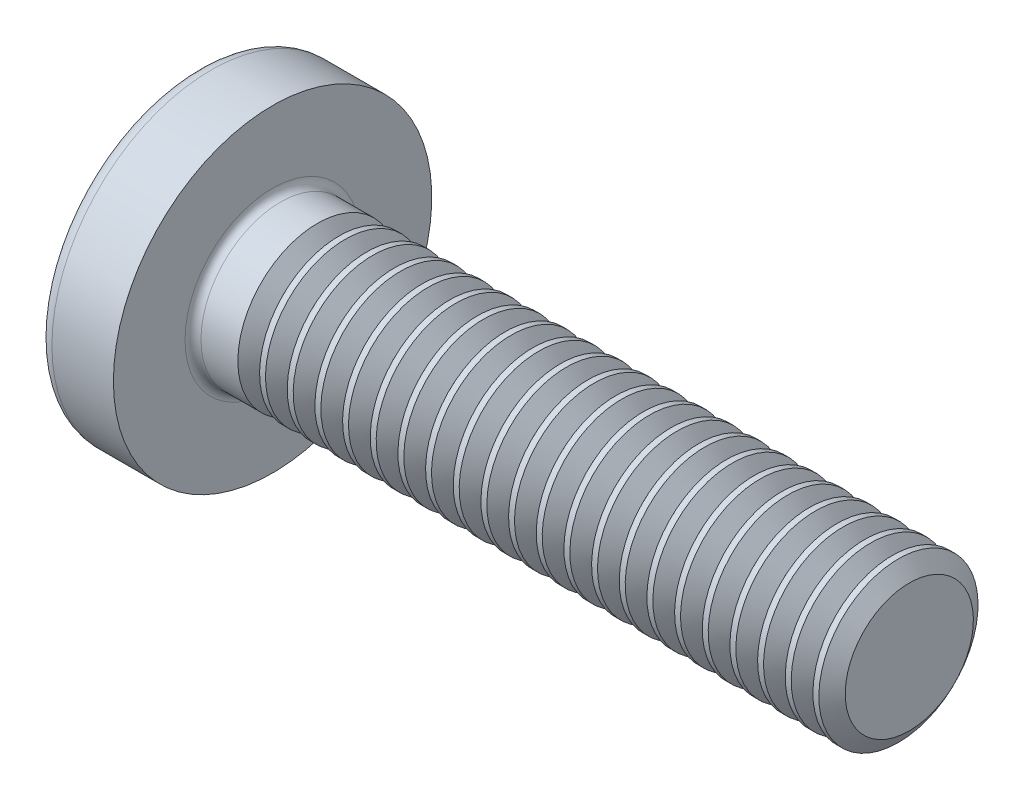
from build123d import *

# Parameters (mm, degrees)
FILLET1_R       = 0.2
RECPAT_COUNT    = 2
RECPAT_ANGLE    = 90
THDSCHPAT_COUNT = 22
THDSCHPAT_PITCH = 0.695238095


with BuildPart() as part:
    # BodySke → Base-Revolve (revolve)
    with BuildSketch(Plane.XY, mode=Mode.PRIVATE) as base_revolve_sk:
        with BuildLine():
            Line((3.1, 2), (3.1, 4))
            Line((3.1, 4), (1.555305874, 4))
            ThreePointArc((1.555305874, 4), (1.392873227, 3.961271902), (1.265388955, 3.853420195))
            ThreePointArc((1.265388955, 3.853420195), (0.324444487, 2.027933456), (0, 0))
            Line((0, 0), (19.1, 0))
            Line((19.1, 0), (19.1, 2))
            Line((19.1, 2), (3.1, 2))
        make_face()
    revolve(base_revolve_sk.sketch.rotate(Axis((1.555305874, 0, 0), (1, 0, 0)), 90), axis=Axis((1.555305874, 0, 0), (1, 0, 0)))

    # Fillet1
    fillet1_edges = [part.edges().sort_by_distance(p)[0] for p in [
        (3.1, 0, -2),
    ]]
    fillet(fillet1_edges, radius=FILLET1_R)

    # Sketch3 → Recess section 0
    with BuildSketch(Plane(origin=(0, 0, 0), x_dir=(0, 0, -1), z_dir=(1, 0, 0))):
        with BuildLine():
            Line((0.515, -2.15), (-0.515, -2.15))
            Line((-0.515, -2.15), (-0.515, 2.15))
            Line((-0.515, 2.15), (0.515, 2.15))
            Line((0.515, 2.15), (0.515, -2.15))
        make_face()
    # Sketch4 → Recess section 1
    with BuildSketch(Plane(origin=(2.34, 0, 0), x_dir=(0, 0, -1), z_dir=(1, 0, 0))):
        with BuildLine():
            Line((0.515, -0.983319232), (-0.515, -0.983319232))
            Line((-0.515, -0.983319232), (-0.515, 0.983319232))
            Line((-0.515, 0.983319232), (0.515, 0.983319232))
            Line((0.515, 0.983319232), (0.515, -0.983319232))
        make_face()
    recess = loft(mode=Mode.SUBTRACT)

    # RecPat: Recess ×2 about axis
    recpat_axis = Axis((0, 0, 0), (1, 0, 0))
    for i in range(1, RECPAT_COUNT):
        add(recess.rotate(recpat_axis, i * RECPAT_ANGLE / (RECPAT_COUNT - 1)), mode=Mode.SUBTRACT)

    # RecCorSke → RecessCore (revolve, cut)
    with BuildSketch(Plane.XY, mode=Mode.PRIVATE) as recesscore_sk:
        Polygon((0, 0), (0, 1.01462874), (2.34, 0.851), (2.616506661, 0), align=None)
    revolve(recesscore_sk.sketch.rotate(Axis((-3.175, 0, 0), (1, 0, 0)), 14.547591759), axis=Axis((-3.175, 0, 0), (1, 0, 0)), mode=Mode.SUBTRACT)

    # ThdSchSke → ThreadSchematic (revolve, cut)
    with BuildSketch(Plane.XY, mode=Mode.PRIVATE) as threadschematic_sk:
        Polygon((4.5, -1.61), (4.22691906, -2), (4.22691906, -2.5), (4.77308094, -2.5), (4.77308094, -2), align=None)
    threadschematic = revolve(threadschematic_sk.sketch.rotate(Axis((-3.175, 0, 0), (1, 0, 0)), 270), axis=Axis((-3.175, 0, 0), (1, 0, 0)), mode=Mode.SUBTRACT)

    # ThdSchPat: ThreadSchematic ×22
    with Locations(*[(i * THDSCHPAT_PITCH, 0, 0) for i in range(1, THDSCHPAT_COUNT)]):
        add(threadschematic, mode=Mode.SUBTRACT)


solid = part.part
